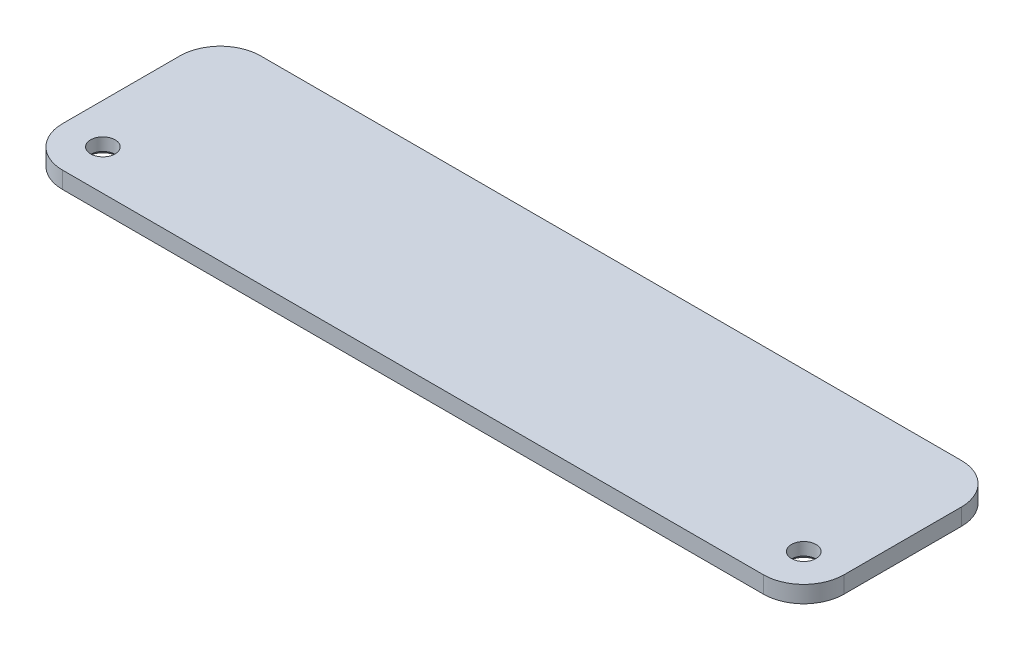
from build123d import *

# Parameters (mm, degrees)
SKETCH1_R           = 1.75
BOSS_EXTRUDE1_DEPTH = 2.4
CHAMFER1_SIZE       = 0.6


with BuildPart() as part:
    # Sketch1 → Boss-Extrude1 (new body)
    with BuildSketch(Plane(origin=(0, 0, 0), x_dir=(1, 0, 0), z_dir=(0, 1, 0))):
        with BuildLine():
            Line((-50, 28.25), (50, 28.25))
            ThreePointArc((50, 28.25), (54.065863992, 26.565863992), (55.75, 22.5))
            Line((55.75, 22.5), (55.75, 5.75))
            ThreePointArc((55.75, 5.75), (54.065863992, 1.684136008), (50, 0))
            Line((50, 0), (-50, 0))
            ThreePointArc((-50, 0), (-54.065863992, 1.684136008), (-55.75, 5.75))
            Line((-55.75, 5.75), (-55.75, 22.5))
            ThreePointArc((-55.75, 22.5), (-54.065863992, 26.565863992), (-50, 28.25))
        make_face()
        with Locations(Location((-50, 5.75, 0), (0, 0, 270))):
            Circle(SKETCH1_R, mode=Mode.SUBTRACT)
        with Locations(Location((50, 5.75, 0), (0, 0, 270))):
            Circle(SKETCH1_R, mode=Mode.SUBTRACT)
    extrude(amount=BOSS_EXTRUDE1_DEPTH)

    # Chamfer1
    chamfer1_edges = [part.edges().sort_by_distance(p)[0] for p in [
        (50, 0, -7.5),
        (-50, 0, -7.5),
    ]]
    chamfer(chamfer1_edges, length=CHAMFER1_SIZE)


solid = part.part
